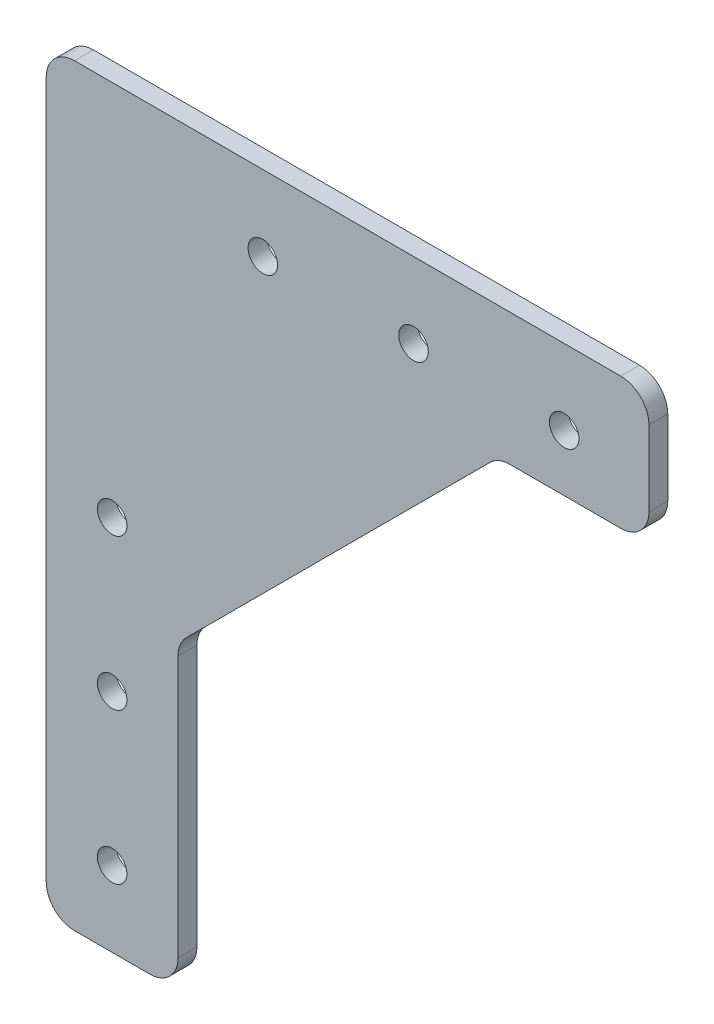
from build123d import *

# Parameters (mm, degrees)
SKETCH1_R           = 2.4892
BOSS_EXTRUDE1_DEPTH = 1.5875
FILLET1_R           = 4.7625


with BuildPart() as part:
    # Sketch1 → Boss-Extrude1 (new, symmetric)
    with BuildSketch(Plane.XY):
        Polygon((0, 0), (0, 127), (101.6, 127), (101.6, 104.775), (76.2, 104.775), (22.225, 50.8), (22.225, 0), align=None)
        with Locations((11.1125, 63.5)):
            Circle(SKETCH1_R, mode=Mode.SUBTRACT)
        with Locations((11.1125, 38.1)):
            Circle(SKETCH1_R, mode=Mode.SUBTRACT)
        with Locations((11.1125, 12.7)):
            Circle(SKETCH1_R, mode=Mode.SUBTRACT)
        with Locations((87.3125, 114.3)):
            Circle(SKETCH1_R, mode=Mode.SUBTRACT)
        with Locations((61.9125, 114.3)):
            Circle(SKETCH1_R, mode=Mode.SUBTRACT)
        with Locations((36.5125, 114.3)):
            Circle(SKETCH1_R, mode=Mode.SUBTRACT)
    extrude(amount=BOSS_EXTRUDE1_DEPTH, both=True)

    # Fillet1
    fillet1_edges = [part.edges().sort_by_distance(p)[0] for p in [
        (22.225, 0, 0),
        (22.225, 50.8, 0),
        (76.2, 104.775, 0),
        (101.6, 104.775, 0),
        (101.6, 127, 0),
        (0, 127, 0),
        (0, 0, 0),
    ]]
    fillet(fillet1_edges, radius=FILLET1_R)


solid = part.part
